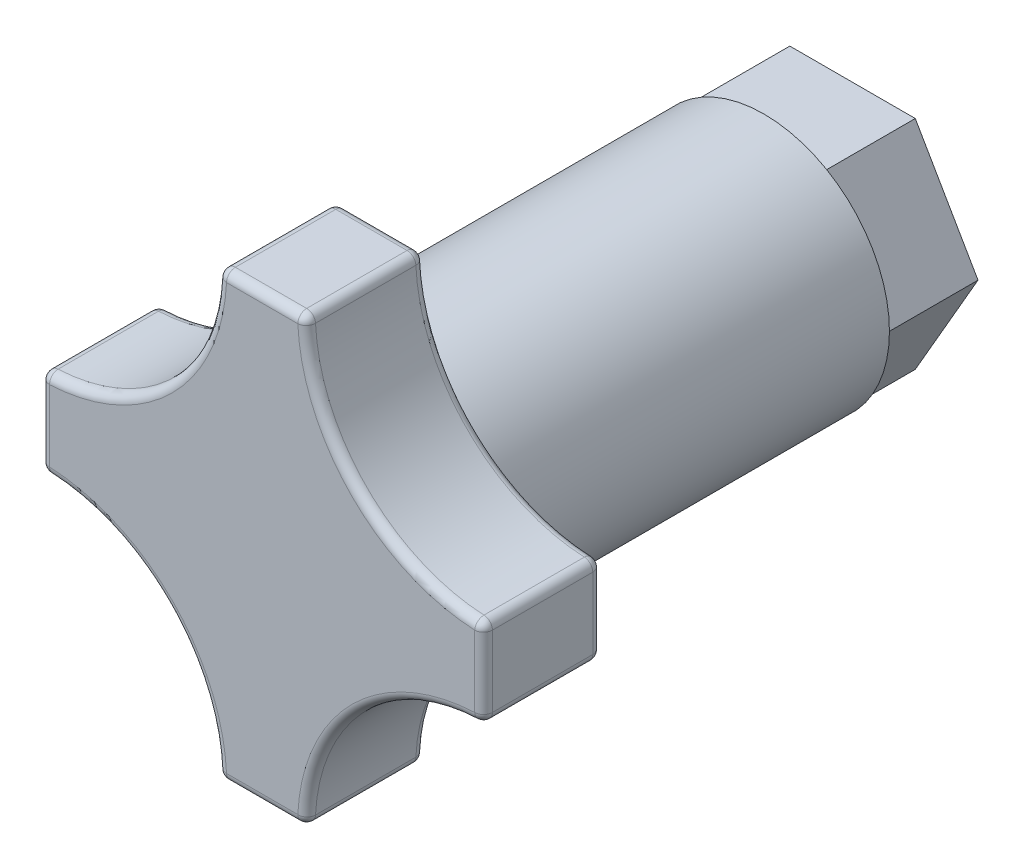
from build123d import *

# Parameters (mm, degrees)
SKETCH1_R           = 8.5
BOSS_EXTRUDE1_DEPTH = 40
BOSS_EXTRUDE2_START = -8
SKETCH2_W           = 6
SKETCH2_H           = 6
BOSS_EXTRUDE2_DEPTH = 8
SKETCH3_OUTSIDE_W   = 43.662
SKETCH3_OUTSIDE_H   = 43.662
CUT_EXTRUDE1_DEPTH  = 6
FILLET2_R           = 0.6


with BuildPart() as part:
    # Sketch1 → Boss-Extrude1 (new body)
    with BuildSketch(Plane.XY):
        Circle(SKETCH1_R)
    extrude(amount=BOSS_EXTRUDE1_DEPTH)

    # Sketch2 → Boss-Extrude2 (add)
    with BuildSketch(Plane.XY.offset(40).offset(BOSS_EXTRUDE2_START)):
        with BuildLine():
            Line((3, 7.95298686), (3, 15))
            Line((3, 15), (-3, 15))
            Line((-3, 15), (-3, 7.95298686))
            ThreePointArc((-3, 7.95298686), (0, 8.5), (3, 7.95298686))
        make_face()
        with BuildLine():
            Line((-7.95298686, 3), (-3, 3))
            Line((-3, 3), (-3, 7.95298686))
            ThreePointArc((-3, 7.95298686), (-6.01040764, 6.01040764), (-7.95298686, 3))
        make_face()
        with BuildLine():
            Line((-3, 7.95298686), (-3, 15))
            ThreePointArc((-3, 15), (-6.514718626, 6.514718626), (-15, 3))
            Line((-15, 3), (-7.95298686, 3))
            ThreePointArc((-7.95298686, 3), (-6.01040764, 6.01040764), (-3, 7.95298686))
        make_face()
        with BuildLine():
            Line((-3, 3), (3, 3))
            Line((3, 3), (3, 7.95298686))
            ThreePointArc((3, 7.95298686), (0, 8.5), (-3, 7.95298686))
            Line((-3, 7.95298686), (-3, 3))
        make_face()
        Rectangle(SKETCH2_W, SKETCH2_H)
        with BuildLine():
            Line((-3, -3), (-3, 3))
            Line((-3, 3), (-7.95298686, 3))
            ThreePointArc((-7.95298686, 3), (-8.5, 0), (-7.95298686, -3))
            Line((-7.95298686, -3), (-3, -3))
        make_face()
        with BuildLine():
            Line((-7.95298686, 3), (-15, 3))
            Line((-15, 3), (-15, -3))
            Line((-15, -3), (-7.95298686, -3))
            ThreePointArc((-7.95298686, -3), (-8.5, 0), (-7.95298686, 3))
        make_face()
        with BuildLine():
            ThreePointArc((-15, -3), (-6.514718626, -6.514718626), (-3, -15))
            Line((-3, -15), (-3, -7.95298686))
            ThreePointArc((-3, -7.95298686), (-6.01040764, -6.01040764), (-7.95298686, -3))
            Line((-7.95298686, -3), (-15, -3))
        make_face()
        with BuildLine():
            Line((-3, -7.95298686), (-3, -3))
            Line((-3, -3), (-7.95298686, -3))
            ThreePointArc((-7.95298686, -3), (-6.01040764, -6.01040764), (-3, -7.95298686))
        make_face()
        with BuildLine():
            Line((3, -7.95298686), (3, -3))
            Line((3, -3), (-3, -3))
            Line((-3, -3), (-3, -7.95298686))
            ThreePointArc((-3, -7.95298686), (0, -8.5), (3, -7.95298686))
        make_face()
        with BuildLine():
            ThreePointArc((3, -7.95298686), (6.01040764, -6.01040764), (7.95298686, -3))
            Line((7.95298686, -3), (3, -3))
            Line((3, -3), (3, -7.95298686))
        make_face()
        with BuildLine():
            ThreePointArc((8.5, 0), (8.362128566, 1.524731401), (7.95298686, 3))
            Line((7.95298686, 3), (3, 3))
            Line((3, 3), (3, -3))
            Line((3, -3), (7.95298686, -3))
            ThreePointArc((7.95298686, -3), (8.362128566, -1.524731401), (8.5, 0))
        make_face()
        with BuildLine():
            ThreePointArc((3, -15), (6.514718626, -6.514718626), (15, -3))
            Line((15, -3), (7.95298686, -3))
            ThreePointArc((7.95298686, -3), (6.01040764, -6.01040764), (3, -7.95298686))
            Line((3, -7.95298686), (3, -15))
        make_face()
        with BuildLine():
            Line((15, -3), (15, 3))
            Line((15, 3), (7.95298686, 3))
            ThreePointArc((7.95298686, 3), (8.362128566, 1.524731401), (8.5, 0))
            ThreePointArc((8.5, 0), (8.362128566, -1.524731401), (7.95298686, -3))
            Line((7.95298686, -3), (15, -3))
        make_face()
        with BuildLine():
            Line((7.95298686, 3), (15, 3))
            ThreePointArc((15, 3), (6.514718626, 6.514718626), (3, 15))
            Line((3, 15), (3, 7.95298686))
            ThreePointArc((3, 7.95298686), (6.01040764, 6.01040764), (7.95298686, 3))
        make_face()
        with BuildLine():
            Line((3, 3), (7.95298686, 3))
            ThreePointArc((7.95298686, 3), (6.01040764, 6.01040764), (3, 7.95298686))
            Line((3, 7.95298686), (3, 3))
        make_face()
        with BuildLine():
            Line((-3, -15), (3, -15))
            Line((3, -15), (3, -7.95298686))
            ThreePointArc((3, -7.95298686), (0, -8.5), (-3, -7.95298686))
            Line((-3, -7.95298686), (-3, -15))
        make_face()
    extrude(amount=BOSS_EXTRUDE2_DEPTH)

    # Sketch3 outside → Cut-Extrude1 (cut)
    with BuildSketch(Plane(origin=(0, 0, 0), x_dir=(-1, 0, 0), z_dir=(0, 0, -1))):
        Rectangle(SKETCH3_OUTSIDE_W, SKETCH3_OUTSIDE_H)
        Polygon((4.25, 7.361215932), (-4.25, 7.361215932), (-8.5, 0), (-4.25, -7.361215932), (4.25, -7.361215932), (8.5, 0), align=None, mode=Mode.SUBTRACT)
    extrude(amount=-CUT_EXTRUDE1_DEPTH, mode=Mode.SUBTRACT)

    # Fillet2
    fillet2_edges = [part.edges().sort_by_distance(p)[0] for p in [
        (15, 0, 32),
        (6.514718626, -6.514718626, 32),
        (0, -15, 32),
        (0, 15, 40),
        (-6.514718626, 6.514718626, 40),
        (-15, 0, 40),
        (-6.514718626, -6.514718626, 40),
        (-3, -15, 36),
        (-15, 0, 32),
        (-15, -3, 36),
        (-6.514718626, 6.514718626, 32),
        (-15, 3, 36),
        (0, 15, 32),
        (-3, 15, 36),
        (6.514718626, 6.514718626, 40),
        (3, 15, 36),
        (15, 0, 40),
        (15, 3, 36),
        (6.514718626, -6.514718626, 40),
        (15, -3, 36),
        (0, -15, 40),
        (3, -15, 36),
        (-6.514718626, -6.514718626, 32),
        (6.514718626, 6.514718626, 32),
    ]]
    fillet(fillet2_edges, radius=FILLET2_R)


solid = part.part
